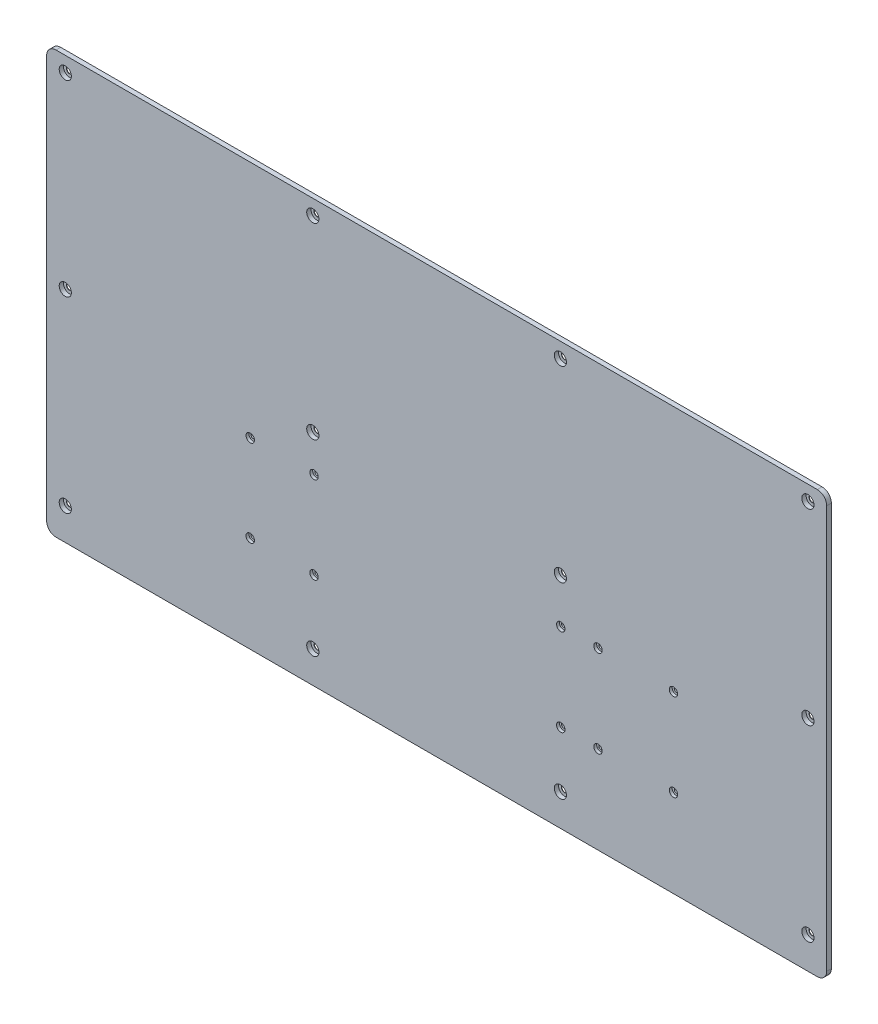
from build123d import *

# Parameters (mm, degrees)
BOSS_EXTRU_1_DEPTH                           = 5
D_GAGEMENT_M61_D                             = 6.6
R_P_TITION_LIN_AIRE1_COUNT                   = 5
R_P_TITION_LIN_AIRE1_PITCH                   = 100
R_P_TITION_LIN_AIRE1_COUNT_DIR2              = 4
R_P_TITION_LIN_AIRE1_PITCH_DIR2              = 264
CHAMBRAGE_POUR_VIS_T_TE_RONDE_BOMB_2_A_COUNT = 2
CHAMBRAGE_POUR_VIS_T_TE_RONDE_BOMB_2_A_PITCH = 39.666786558
CHAMBRAGE_POUR_VIS_T_TE_RONDE_BOMB_3_COUNT   = 2
CHAMBRAGE_POUR_VIS_T_TE_RONDE_BOMB_3_PITCH   = 120.176992244
R_P_TITION_LIN_AIRE2_COUNT                   = 2
R_P_TITION_LIN_AIRE2_PITCH                   = 93
CHAMBRAGE_POUR_VIS_T_TE_RONDE_BOMB_4_A_COUNT = 2
CHAMBRAGE_POUR_VIS_T_TE_RONDE_BOMB_4_A_PITCH = 92.544451502
R_P_TITION_LIN_AIRE3_COUNT                   = 2
R_P_TITION_LIN_AIRE3_PITCH                   = 68


with BuildPart() as part:
    # Esquisse1 → Boss.-Extru.1 (new body)
    with BuildSketch(Plane.XY):
        with BuildLine():
            Line((-406, -225), (406, -225))
            ThreePointArc((406, -225), (413.071067812, -222.071067812), (416, -215))
            Line((416, -215), (416, 215))
            ThreePointArc((416, 215), (413.071067812, 222.071067812), (406, 225))
            Line((406, 225), (-406, 225))
            ThreePointArc((-406, 225), (-413.071067812, 222.071067812), (-416, 215))
            Line((-416, 215), (-416, -215))
            ThreePointArc((-416, -215), (-413.071067812, -222.071067812), (-406, -225))
        make_face()
    extrude(amount=BOSS_EXTRU_1_DEPTH)

    # Dégagement M61 (through all)
    with Locations(Plane(origin=(0, 0, 0), x_dir=(-1, 0, 0), z_dir=(0, 0, -1))):
        with Locations((-395.919753935, 208.872368656)):
            Hole(D_GAGEMENT_M61_D / 2)

    # Esquisse4 → Chambrage pour vis _ t_te ronde bomb_e M (revolve, cut)
    with BuildSketch(Plane(origin=(395.919753935, 208.872368656, 5), x_dir=(0, -1, 0), z_dir=(1, 0, 0))):
        Polygon((0, 0), (0, 5), (3.3, 5), (3.3, 4.625), (3.325, 4.6), (6.5, 4.6), (6.5, 0), align=None)
    chambrage_pour_vis_t_te_ronde_bomb_e_m = revolve(axis=Axis((395.919753935, 208.872368656, 11.35), (0, 0, -1)), mode=Mode.SUBTRACT)

    # Répétition linéaire1: Chambrage pour vis _ t_te ronde bomb_e M 5 × 4, 8 skipped
    with Locations(*[(-j * R_P_TITION_LIN_AIRE1_PITCH_DIR2, -i * R_P_TITION_LIN_AIRE1_PITCH, 0) for i in range(R_P_TITION_LIN_AIRE1_COUNT) for j in range(R_P_TITION_LIN_AIRE1_COUNT_DIR2) if (i, j) not in ((0, 0), (1, 0), (1, 1), (1, 2), (1, 3), (3, 0), (3, 1), (3, 2), (3, 3))]):
        add(chambrage_pour_vis_t_te_ronde_bomb_e_m, mode=Mode.SUBTRACT)

    # Esquisse6 → Chambrage pour vis _ t_te ronde bomb 2 (revolve, cut)
    with BuildSketch(Plane(origin=(132.393542226, -131.456581801, 5), x_dir=(0, -1, 0), z_dir=(1, 0, 0))):
        Polygon((0, 0), (0, 5), (2.25, 5), (2.25, 3.125), (2.275, 3.1), (4.5, 3.1), (4.5, 0), align=None)
    chambrage_pour_vis_t_te_ronde_bomb_2 = revolve(axis=Axis((132.393542226, -131.456581801, 11.35), (0, 0, -1)), mode=Mode.SUBTRACT)

    # Chambrage pour vis _ t_te ronde bomb 2 a: Chambrage pour vis _ t_te ronde bomb 2 ×2
    with Locations(*[(i * CHAMBRAGE_POUR_VIS_T_TE_RONDE_BOMB_2_A_PITCH, 0, 0) for i in range(1, CHAMBRAGE_POUR_VIS_T_TE_RONDE_BOMB_2_A_COUNT)]):
        add(chambrage_pour_vis_t_te_ronde_bomb_2, mode=Mode.SUBTRACT)

    # Chambrage pour vis _ t_te ronde bomb 3: Chambrage pour vis _ t_te ronde bomb 2 ×2
    with Locations(*[(i * CHAMBRAGE_POUR_VIS_T_TE_RONDE_BOMB_3_PITCH, 0, 0) for i in range(1, CHAMBRAGE_POUR_VIS_T_TE_RONDE_BOMB_3_COUNT)]):
        add(chambrage_pour_vis_t_te_ronde_bomb_2, mode=Mode.SUBTRACT)

    # Répétition linéaire2: Chambrage pour vis _ t_te ronde bomb 2 ×2
    with Locations(*[(0, i * R_P_TITION_LIN_AIRE2_PITCH, 0) for i in range(1, R_P_TITION_LIN_AIRE2_COUNT)]):
        add(chambrage_pour_vis_t_te_ronde_bomb_2, mode=Mode.SUBTRACT)

    # Répétition linéaire2 copy 1 sketch → Répétition linéaire2 copy 1 (revolve, cut)
    with BuildSketch(Plane(origin=(172.060328783, -38.456581801, 5), x_dir=(0, -1, 0), z_dir=(1, 0, 0))):
        Polygon((0, 0), (0, 5), (2.25, 5), (2.25, 3.125), (2.275, 3.1), (4.5, 3.1), (4.5, 0), align=None)
    revolve(axis=Axis((172.060328783, -38.456581801, 11.35), (0, 0, -1)), mode=Mode.SUBTRACT)

    # Répétition linéaire2 copy 2 sketch → Répétition linéaire2 copy 2 (revolve, cut)
    with BuildSketch(Plane(origin=(252.57053447, -38.456581801, 5), x_dir=(0, -1, 0), z_dir=(1, 0, 0))):
        Polygon((0, 0), (0, 5), (2.25, 5), (2.25, 3.125), (2.275, 3.1), (4.5, 3.1), (4.5, 0), align=None)
    revolve(axis=Axis((252.57053447, -38.456581801, 11.35), (0, 0, -1)), mode=Mode.SUBTRACT)

    # Esquisse9 → Chambrage pour vis _ t_te ronde bomb 4 (revolve, cut)
    with BuildSketch(Plane(origin=(-130.81547906, -122.256295557, 5), x_dir=(0, -1, 0), z_dir=(1, 0, 0))):
        Polygon((0, 0), (0, 5), (2.25, 5), (2.25, 3.125), (2.275, 3.1), (4.5, 3.1), (4.5, 0), align=None)
    chambrage_pour_vis_t_te_ronde_bomb_4 = revolve(axis=Axis((-130.81547906, -122.256295557, 11.35), (0, 0, -1)), mode=Mode.SUBTRACT)

    # Chambrage pour vis _ t_te ronde bomb 4 a: Chambrage pour vis _ t_te ronde bomb 4 ×2
    with Locations(*[(0, i * CHAMBRAGE_POUR_VIS_T_TE_RONDE_BOMB_4_A_PITCH, 0) for i in range(1, CHAMBRAGE_POUR_VIS_T_TE_RONDE_BOMB_4_A_COUNT)]):
        add(chambrage_pour_vis_t_te_ronde_bomb_4, mode=Mode.SUBTRACT)

    # Répétition linéaire3: Chambrage pour vis _ t_te ronde bomb 4 ×2
    with Locations(*[(-i * R_P_TITION_LIN_AIRE3_PITCH, 0, 0) for i in range(1, R_P_TITION_LIN_AIRE3_COUNT)]):
        add(chambrage_pour_vis_t_te_ronde_bomb_4, mode=Mode.SUBTRACT)

    # Répétition linéaire3 copy 1 sketch → Répétition linéaire3 copy 1 (revolve, cut)
    with BuildSketch(Plane(origin=(-198.81547906, -29.711844055, 5), x_dir=(0, -1, 0), z_dir=(1, 0, 0))):
        Polygon((0, 0), (0, 5), (2.25, 5), (2.25, 3.125), (2.275, 3.1), (4.5, 3.1), (4.5, 0), align=None)
    revolve(axis=Axis((-198.81547906, -29.711844055, 11.35), (0, 0, -1)), mode=Mode.SUBTRACT)


solid = part.part
